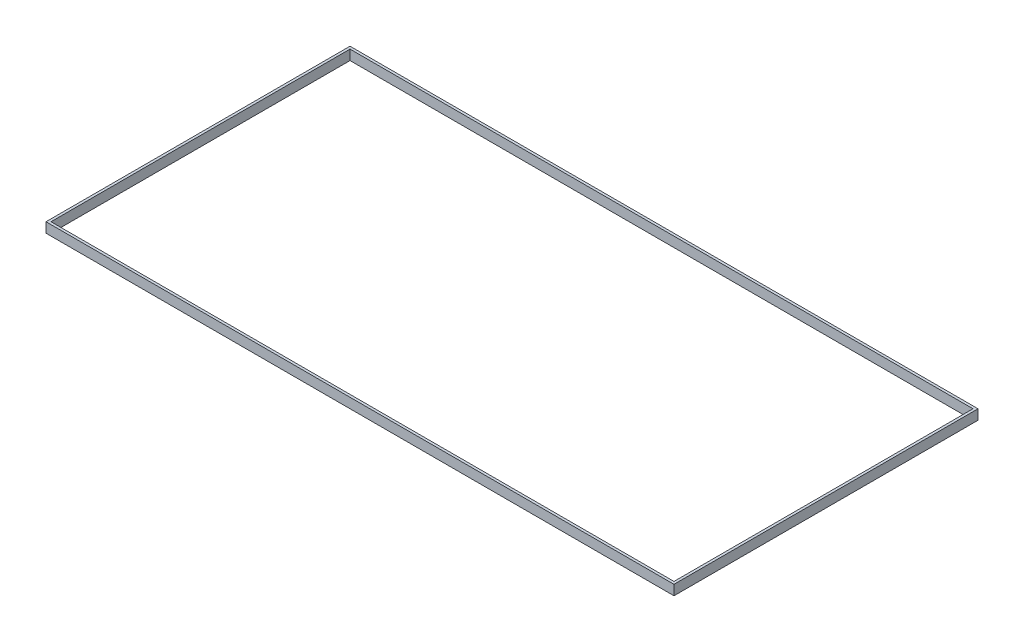
from build123d import *

# Parameters (mm, degrees)
SKETCH1_W           = 1260
SKETCH1_H           = 610
SKETCH1_W_2         = 1250
SKETCH1_H_2         = 600
BOSS_EXTRUDE1_DEPTH = 20


with BuildPart() as part:
    # Sketch1 → Boss-Extrude1 (new body)
    with BuildSketch(Plane(origin=(0, 0, 0), x_dir=(1, 0, 0), z_dir=(0, 1, 0))):
        Rectangle(SKETCH1_W, SKETCH1_H)
        Rectangle(SKETCH1_W_2, SKETCH1_H_2, mode=Mode.SUBTRACT)
    extrude(amount=BOSS_EXTRUDE1_DEPTH)


solid = part.part
